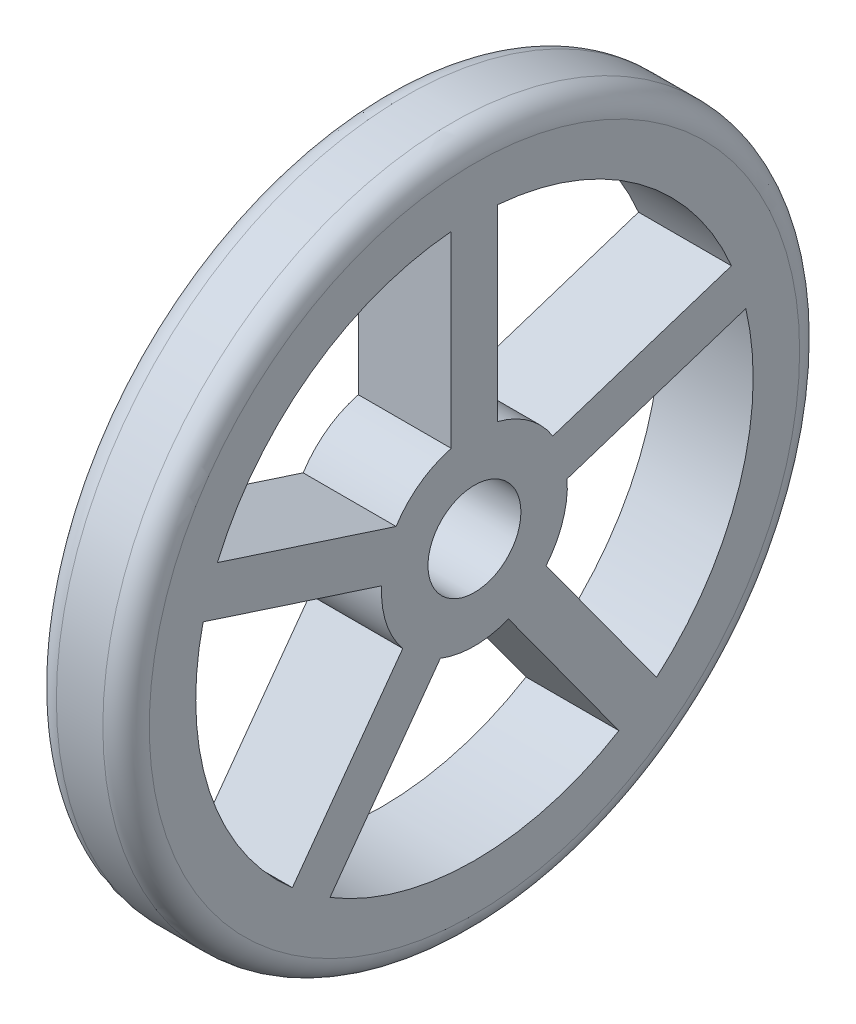
from build123d import *

# Parameters (mm, degrees)
SKETCH2_R           = 150
SKETCH2_R_2         = 20
BOSS_EXTRUDE1_DEPTH = 40
FILLET1_R           = 10


with BuildPart() as part:
    # Sketch2 → Boss-Extrude1 (new body)
    with BuildSketch(Plane(origin=(0, 0, 0), x_dir=(0, 0, -1), z_dir=(1, 0, 0))):
        Circle(SKETCH2_R)
        Circle(SKETCH2_R_2, mode=Mode.SUBTRACT)
        with BuildLine():
            Line((110.639648089, 46.463623091), (33.744090545, 21.478741892))
            ThreePointArc((33.744090545, 21.478741892), (23.511410092, 32.360679775), (10, 38.729833462))
            Line((10, 38.729833462), (10, 119.582607431))
            ThreePointArc((10, 119.582607431), (70.534230275, 97.082039325), (110.639648089, 46.463623091))
        make_face(mode=Mode.SUBTRACT)
        with BuildLine():
            Line((-10, 119.582607431), (-10, 38.729833462))
            ThreePointArc((-10, 38.729833462), (-23.511410092, 32.360679775), (-33.744090545, 21.478741892))
            Line((-33.744090545, 21.478741892), (-110.639648089, 46.463623091))
            ThreePointArc((-110.639648089, 46.463623091), (-70.534230275, 97.082039325), (-10, 119.582607431))
        make_face(mode=Mode.SUBTRACT)
        with BuildLine():
            Line((116.819987977, 27.442492765), (39.924430433, 2.457611566))
            ThreePointArc((39.924430433, 2.457611566), (38.042260652, -12.360679775), (30.854994877, -25.455240937))
            Line((30.854994877, -25.455240937), (78.379063022, -90.86650912))
            ThreePointArc((78.379063022, -90.86650912), (114.126781955, -37.082039325), (116.819987977, 27.442492765))
        make_face(mode=Mode.SUBTRACT)
        with BuildLine():
            Line((62.198723135, -102.622214166), (14.674654989, -37.210945983))
            ThreePointArc((14.674654989, -37.210945983), (0, -40), (-14.674654989, -37.210945983))
            Line((-14.674654989, -37.210945983), (-62.198723135, -102.622214166))
            ThreePointArc((-62.198723135, -102.622214166), (0, -120), (62.198723135, -102.622214166))
        make_face(mode=Mode.SUBTRACT)
        with BuildLine():
            Line((-78.379063022, -90.86650912), (-30.854994877, -25.455240937))
            ThreePointArc((-30.854994877, -25.455240937), (-38.042260652, -12.360679775), (-39.924430433, 2.457611566))
            Line((-39.924430433, 2.457611566), (-116.819987977, 27.442492765))
            ThreePointArc((-116.819987977, 27.442492765), (-114.126781955, -37.082039325), (-78.379063022, -90.86650912))
        make_face(mode=Mode.SUBTRACT)
    extrude(amount=BOSS_EXTRUDE1_DEPTH)

    # Fillet1
    fillet1_edges = [part.edges().sort_by_distance(p)[0] for p in [
        (0, 0, 150),
        (40, 0, 150),
    ]]
    fillet(fillet1_edges, radius=FILLET1_R)


solid = part.part
